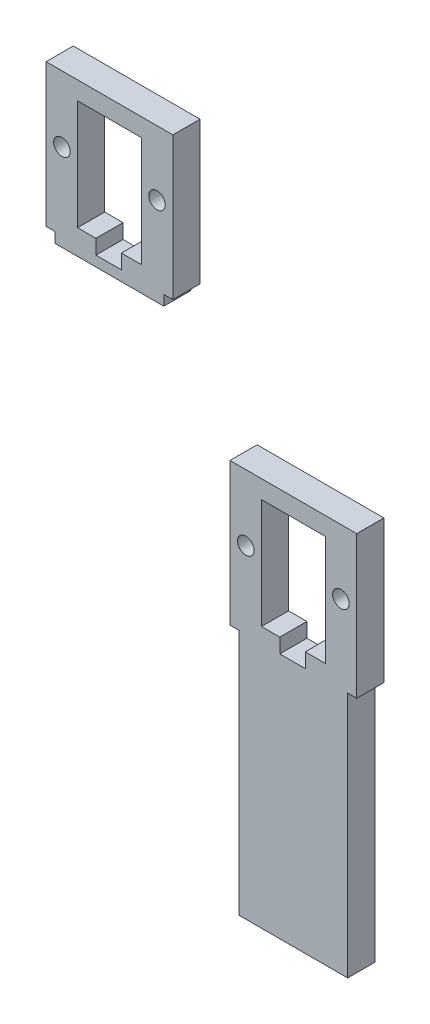
from build123d import *

# Parameters (mm, degrees)
SKETCH1_R           = 1.825
BOSS_EXTRUDE1_DEPTH = 6
SKETCH3_R           = 1.825
BOSS_EXTRUDE2_DEPTH = 6


with BuildPart() as part:
    # Sketch1 → Boss-Extrude1 (new body)
    with BuildSketch(Plane.XY):
        Polygon((3.767928447, -62.86956086), (-8.232071553, -62.86956086), (-8.232071553, -8.37428403), (-10.232071553, -8.37428403), (-10.232071553, 23.13043914), (-8.232071553, 23.13043914), (3.767928447, 23.13043914), (15.767928447, 23.13043914), (17.767928447, 23.13043914), (17.767928447, -8.37428403), (15.767928447, -8.37428403), (15.767928447, -62.86956086), align=None)
        with Locations((-6.732071553, 8.575211091)):
            Circle(SKETCH1_R, mode=Mode.SUBTRACT)
        with Locations((14.267928447, 8.870590402)):
            Circle(SKETCH1_R, mode=Mode.SUBTRACT)
        Polygon((3.767928447, 19.13043914), (-3.287071553, 19.13043914), (-3.287071553, -5.15956086), (0.76863058, -5.15956086), (0.76863058, -8.37428403), (6.399888712, -8.37428403), (6.399888712, -5.15956086), (10.822928447, -5.15956086), (10.822928447, 19.13043914), align=None, mode=Mode.SUBTRACT)
    extrude(amount=BOSS_EXTRUDE1_DEPTH)


with BuildPart() as body_2:
    # Sketch3 → Boss-Extrude2 (new body)
    with BuildSketch(Plane.XY):
        Polygon((-36.844661852, 45.324982103), (-48.844661852, 45.324982103), (-48.844661852, 47.59819619), (-50.844661852, 47.59819619), (-50.844661852, 79.10291936), (-48.844661852, 79.10291936), (-36.844661852, 79.10291936), (-24.844661852, 79.10291936), (-22.844661852, 79.10291936), (-22.844661852, 47.59819619), (-24.844661852, 47.59819619), (-24.844661852, 45.324982103), align=None)
        with Locations((-47.344661852, 64.547691311)):
            Circle(SKETCH3_R, mode=Mode.SUBTRACT)
        with Locations((-26.344661852, 64.843070622)):
            Circle(SKETCH3_R, mode=Mode.SUBTRACT)
        Polygon((-36.844661852, 75.10291936), (-43.899661852, 75.10291936), (-43.899661852, 50.81291936), (-39.843959719, 50.81291936), (-39.843959719, 47.59819619), (-34.212701587, 47.59819619), (-34.212701587, 50.81291936), (-29.789661852, 50.81291936), (-29.789661852, 75.10291936), align=None, mode=Mode.SUBTRACT)
    extrude(amount=BOSS_EXTRUDE2_DEPTH)


solid = Compound([part.part, body_2.part])
